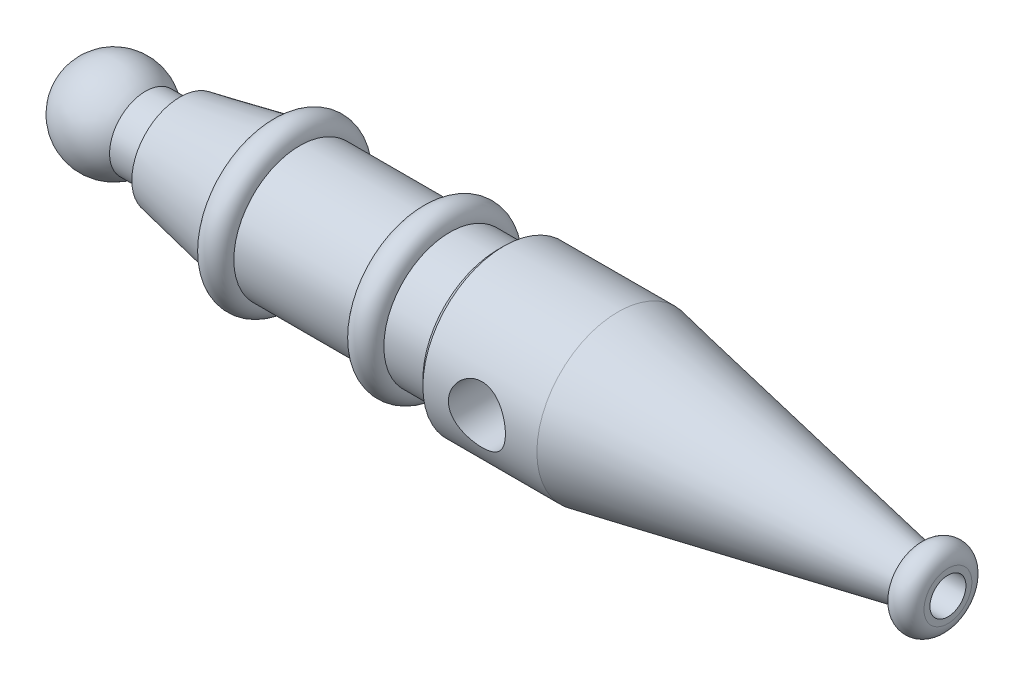
from build123d import *

# Parameters (mm, degrees)
CHAMFER1_SIZE      = 1
SKETCH3_R          = 4.75
CUT_EXTRUDE1_DEPTH = 20


with BuildPart() as part:
    # Sketch1 → Revolve1 (revolve)
    with BuildSketch(Plane.XY, mode=Mode.PRIVATE) as revolve1_sk:
        with BuildLine():
            Line((-91.855737705, 0), (5.144262295, 0))
            Line((5.144262295, 0), (5.144262295, 3))
            Line((5.144262295, 3), (55.144262295, 3))
            Line((55.144262295, 3), (55.144262295, 3.985209508))
            ThreePointArc((55.144262295, 3.985209508), (52.644262295, 6.485209508), (50.144262295, 3.985209508))
            Line((50.144262295, 3.985209508), (0.144262295, 13.5))
            Line((0.144262295, 13.5), (-19.855737705, 13.5))
            Line((-19.855737705, 13.5), (-19.855737705, 11))
            Line((-19.855737705, 11), (-27.855737705, 11))
            ThreePointArc((-27.855737705, 11), (-30.355737705, 13.5), (-32.855737705, 11))
            Line((-32.855737705, 11), (-52.855737705, 11))
            ThreePointArc((-52.855737705, 11), (-55.355737705, 13.5), (-57.855737705, 11))
            Line((-57.855737705, 11), (-72.855737705, 8))
            Line((-72.855737705, 8), (-72.855737705, 6))
            Line((-72.855737705, 6), (-78.564235083, 6))
            ThreePointArc((-78.564235083, 6), (-87.147240327, 7.291502622), (-91.855737705, 0))
        make_face()
    revolve(revolve1_sk.sketch.rotate(Axis((-1091.855737705, 0, 0), (1, 0, 0)), 90), axis=Axis((-1091.855737705, 0, 0), (1, 0, 0)))

    # Chamfer1
    chamfer1_edges = [part.edges().sort_by_distance(p)[0] for p in [
        (-19.855737705, 0, -13.5),
    ]]
    chamfer(chamfer1_edges, length=CHAMFER1_SIZE)

    # Sketch3 → Cut-Extrude1 (cut, symmetric)
    with BuildSketch(Plane.XY):
        with Locations((-9.855737705, 0)):
            Circle(SKETCH3_R)
    extrude(amount=CUT_EXTRUDE1_DEPTH, both=True, mode=Mode.SUBTRACT)


solid = part.part
